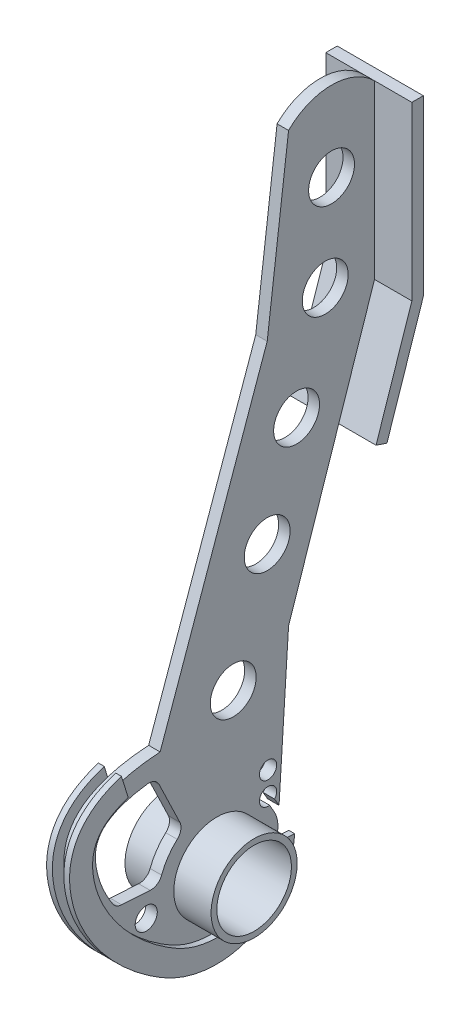
from build123d import *

# Parameters (mm, degrees)
SKETCH1_R               = 12.7
SKETCH1_R_2             = 8
SKETCH1_R_3             = 15
BOSS_EXTRUDE1_DEPTH     = 2
BOSS_EXTRUDE2_DEPTH     = 15
SKETCH3_R               = 15
SKETCH3_R_2             = 13
BOSS_EXTRUDE3_DEPTH     = 15
CUT_EXTRUDE1_DEPTH      = 269.802954327
CUT_EXTRUDE1_DEPTH_BACK = 269.802954327
BOSS_EXTRUDE4_DEPTH     = 2
CUT_EXTRUDE2_DEPTH      = 269.802954424
CUT_EXTRUDE2_DEPTH_BACK = 269.802954424
SKETCH6_R               = 3.852342377
SKETCH6_R_2             = 3
FILLET1_R               = 4
BOSS_EXTRUDE5_DEPTH     = 2
FILLET2_R               = 10


with BuildPart() as part:
    # Sketch1 → Boss-Extrude1 (new, symmetric)
    with BuildSketch(Plane(origin=(0, 0, 0), x_dir=(0, 0, -1), z_dir=(1, 0, 0))):
        with BuildLine():
            Line((30.078103468, 30.102899094), (30.078103468, 104.858637586))
            Line((30.078103468, 104.858637586), (43.656234688, 145.478166756))
            Line((43.656234688, 145.478166756), (60.038536544, 194.486485935))
            Line((60.038536544, 194.486485935), (60.038536544, 254.427096014))
            ThreePointArc((60.038536544, 254.427096014), (45.05832001, 260.632104877), (30.078103469, 254.427096029))
            Line((30.078103469, 254.427096029), (22.62926434, 194.486485916))
            Line((22.62926434, 194.486485916), (-14.683335653, 89.230795609))
            Line((-14.683335653, 89.230795609), (-17.49123357, 0.553848547))
            ThreePointArc((-17.49123357, 0.553848547), (-3.415184823, -17.163522734), (16.370945819, -6.184022397))
            Line((16.370945819, -6.184022397), (30.078103468, 30.102899094))
        make_face()
        Circle(SKETCH1_R, mode=Mode.SUBTRACT)
        with Locations((45.058319997, 232.788133995)):
            Circle(SKETCH1_R_2, mode=Mode.SUBTRACT)
        with Locations((42.85515341, 200.574247039)):
            Circle(SKETCH1_R_2, mode=Mode.SUBTRACT)
        with Locations((32.877400798, 166.36480954)):
            Circle(SKETCH1_R_2, mode=Mode.SUBTRACT)
        with Locations((22.629264347, 133.284451418)):
            Circle(SKETCH1_R_2, mode=Mode.SUBTRACT)
        with Locations((10.792452444, 95.075946031)):
            Circle(SKETCH1_R_2, mode=Mode.SUBTRACT)
        with Locations((5.075535148, 44.712849864)):
            Circle(SKETCH1_R_3, mode=Mode.SUBTRACT)
    extrude(amount=BOSS_EXTRUDE1_DEPTH, both=True)

    # Sketch2 → Boss-Extrude2 (add, symmetric)
    with BuildSketch(Plane(origin=(0, 0, 0), x_dir=(0, 0, -1), z_dir=(1, 0, 0))):
        Polygon((47.563588116, 157.167172724), (60.038536544, 194.486485935), (60.038536544, 254.427096014), (64.038536544, 254.427096014), (64.038536544, 193.835634299), (51.357247167, 155.899043786), align=None)
    extrude(amount=BOSS_EXTRUDE2_DEPTH, both=True)

    # Sketch3 → Boss-Extrude3 (add, symmetric)
    with BuildSketch(Plane(origin=(0, 0, 0), x_dir=(0, 0, -1), z_dir=(1, 0, 0))):
        with Locations((5.075535148, 44.712849864)):
            Circle(SKETCH3_R)
        with Locations((5.075535148, 44.712849864)):
            Circle(SKETCH3_R_2, mode=Mode.SUBTRACT)
    extrude(amount=BOSS_EXTRUDE3_DEPTH, both=True)

    # Sketch4 → Cut-Extrude1 (cut, two sides: drawn at the far end of the back side and taken through both)
    with BuildSketch(Plane(origin=(0, 0, 0), x_dir=(0, 0, -1), z_dir=(1, 0, 0)).offset(-CUT_EXTRUDE1_DEPTH_BACK)):
        with BuildLine():
            Line((30.078103468, 104.858637586), (26.191278068, 43.377907902))
            ThreePointArc((26.191278068, 43.377907902), (4.407731446, 23.565492882), (-16.082363356, 44.712849864))
            Line((-16.082363356, 44.712849864), (-29.154102158, 44.712849864))
            Line((-29.154102158, 44.712849864), (-29.154102158, 7.504286016))
            Line((-29.154102158, 7.504286016), (-19.281981281, -21.725135581))
            Line((-19.281981281, -21.725135581), (13.670399251, -21.725135581))
            Line((13.670399251, -21.725135581), (36.161706599, 11.227244951))
            Line((36.161706599, 11.227244951), (36.161706599, 104.858637586))
            Line((36.161706599, 104.858637586), (30.078103468, 104.858637586))
        make_face()
    extrude(amount=CUT_EXTRUDE1_DEPTH + CUT_EXTRUDE1_DEPTH_BACK, mode=Mode.SUBTRACT)

    # Sketch5 → Boss-Extrude4 (add, symmetric)
    with BuildSketch(Plane(origin=(0, 0, 0), x_dir=(0, 0, -1), z_dir=(1, 0, 0))):
        with BuildLine():
            Line((-16.082363356, 44.712849864), (-14.683335653, 89.230795609))
            add(Edge.make_bspline(
                [(-14.683335653, 89.230795609), (-43.018615037, 87.412919783), (-49.931265985, 59.370190205), (-26.511116913, 33.203575319), (2.515504255, 16.740747707), (24.905298182, 23.036633571), (26.191278068, 43.377907902)],
                knots=[0, 0, 0, 0, 0.276392856, 0.582042419, 0.658223753, 1, 1, 1, 1], degree=3))
            ThreePointArc((26.191278068, 43.377907902), (4.407731446, 23.565492882), (-16.082363356, 44.712849864))
        make_face()
    extrude(amount=BOSS_EXTRUDE4_DEPTH, both=True)

    # Sketch6 → Cut-Extrude2 (cut, two sides: drawn at the far end of the back side and taken through both)
    with BuildSketch(Plane(origin=(0, 0, 0), x_dir=(0, 0, -1), z_dir=(1, 0, 0)).offset(-CUT_EXTRUDE2_DEPTH_BACK)):
        with Locations((-19.520755852, 41.423227022)):
            Circle(SKETCH6_R)
        with Locations((22.931923345, 65.014687077)):
            Circle(SKETCH6_R_2)
        with BuildLine():
            Line((-18.167116193, 49.188244666), (-30.059033637, 49.940054331))
            add(Edge.make_bspline(
                [(-16.241939744, 82.091687894), (-16.784230913, 82.043262227), (-17.88651773, 81.932514706), (-19.93574854, 81.677748862), (-22.312481373, 81.291478525), (-24.843938902, 80.735170577), (-27.816864317, 79.889300258), (-30.79418636, 78.677162448), (-33.313350945, 77.116508933), (-34.983846176, 75.559250449), (-36.064340209, 74.017357976), (-36.773096061, 72.36348984), (-37.320511488, 69.821463318), (-37.231646879, 66.674580942), (-36.494081763, 63.131921197), (-35.412713951, 59.560213763), (-33.835666743, 56.002198971), (-31.818344114, 52.511691614), (-30.659199505, 50.78026119), (-30.059033637, 49.940054331)],
                knots=[0.007259269, 0.007259269, 0.007259269, 0.007259269, 0.013460155, 0.019661042, 0.032062816, 0.04446459, 0.056866364, 0.081669911, 0.106473459, 0.131277006, 0.156080554, 0.180884101, 0.205687649, 0.255294744, 0.280098291, 0.304901839, 0.354508934, 0.379312481, 0.404116029, 0.404116029, 0.404116029, 0.404116029], degree=3))
            Line((-16.241939744, 82.091687894), (-7.808997403, 64.568298007))
            ThreePointArc((-7.808997403, 64.568298007), (-7.486843803, 62.070471384), (-8.72128321, 59.875231049))
            ThreePointArc((-8.72128321, 59.875231049), (-11.927858504, 56.164251714), (-14.16122498, 51.797838206))
            ThreePointArc((-14.16122498, 51.797838206), (-15.731396551, 49.828705906), (-18.167116193, 49.188244666))
        make_face()
        with BuildLine():
            Line((31.823669454, 43.575587368), (25.209849057, 55.062494859))
            ThreePointArc((25.209849057, 55.062494859), (21.435005127, 59.61454012), (23.476613694, 54.064549381))
            Line((23.476613694, 54.064549381), (30.090434091, 42.577641889))
            Line((30.090434091, 42.577641889), (31.823669454, 43.575587368))
        make_face()
    extrude(amount=CUT_EXTRUDE2_DEPTH + CUT_EXTRUDE2_DEPTH_BACK, mode=Mode.SUBTRACT)

    # Fillet1
    fillet1_edges = [part.edges().sort_by_distance(p)[0] for p in [
        (-1, 82.091687894, 16.241939744),
        (-1, 49.940054331, 30.059033637),
    ]]
    fillet(fillet1_edges, radius=FILLET1_R)

    # Sketch7 → Boss-Extrude5 (add)
    with BuildSketch(Plane(origin=(2, 0, 0), x_dir=(0, 0, -1), z_dir=(1, 0, 0))):
        with BuildLine():
            Line((22.199247779, 43.630284944), (30.183308357, 43.125530859))
            add(Edge.make_bspline(
                [(-30.182273938, 90.62887795), (-30.477102104, 90.536143837), (-31.05900453, 90.346247946), (-33.79533685, 89.386547465), (-37.968857295, 87.413749324), (-42.575559344, 83.807112931), (-45.846696099, 79.421854), (-47.712994208, 74.610225126), (-48.366843365, 69.69801532), (-48.090537376, 64.861286106), (-47.147847972, 60.209356854), (-45.230633964, 54.226062721), (-41.694722437, 47.132990803), (-36.04605422, 39.362918853), (-29.349438931, 32.419037624), (-23.156184009, 27.405962501), (-18.025095774, 23.921539038), (-13.991958588, 21.55457577), (-9.676576889, 19.572373056), (-3.556790736, 17.684319723), (4.365353754, 16.872623556), (12.137866729, 18.30196283), (17.845896009, 20.987591597), (21.731924183, 23.816406725), (25.063742558, 27.474184689), (27.246456473, 31.187747742), (28.57612877, 34.529210242), (29.354831609, 37.212724993), (29.814525561, 39.595917642), (30.064712963, 41.581132894), (30.15092264, 42.613262547), (30.183308357, 43.125530859)],
                knots=[0.056021658, 0.056021658, 0.056021658, 0.056021658, 0.059927908, 0.063834158, 0.09375, 0.125, 0.15625, 0.1875, 0.21875, 0.25, 0.28125, 0.3125, 0.375, 0.4375, 0.5, 0.5625, 0.59375, 0.625, 0.65625, 0.6875, 0.75, 0.8125, 0.84375, 0.875, 0.90625, 0.9375, 0.953125, 0.96875, 0.984375, 0.9921875, 1, 1, 1, 1], degree=3))
            Line((-30.182273938, 90.62887795), (-27.781921947, 82.997475043))
            add(Edge.make_bspline(
                [(-27.781921947, 82.997475043), (-28.181432114, 82.871810055), (-29.501312357, 82.430329455), (-31.508114747, 81.608467084), (-34.292317284, 80.120837256), (-36.840380467, 78.090511183), (-38.762100202, 75.491115034), (-39.878090441, 72.647208982), (-40.32270597, 69.451995121), (-40.138116193, 65.94646467), (-39.394850917, 62.24579382), (-37.825802826, 57.339803194), (-34.850061055, 51.344537916), (-29.918346445, 44.54433997), (-23.93533809, 38.336254781), (-18.361281086, 33.820836374), (-13.711407408, 30.665251531), (-10.248947904, 28.640375887), (-6.793165076, 27.059267801), (-2.046964483, 25.596647602), (4.115058548, 24.973286066), (9.816162722, 26.057107894), (13.759601496, 27.921611258), (16.357572879, 29.817423825), (18.564582106, 32.238898797), (20.051003601, 34.755157206), (20.993446775, 37.117965368), (21.563252469, 39.075778393), (21.911653375, 40.875471752), (22.105477116, 42.410060267), (22.173757685, 43.227089696), (22.199247779, 43.630284944)],
                knots=[0.056021507, 0.056021507, 0.056021507, 0.056021507, 0.0625, 0.078125, 0.09375, 0.125, 0.15625, 0.1875, 0.21875, 0.25, 0.28125, 0.3125, 0.375, 0.4375, 0.5, 0.5625, 0.59375, 0.625, 0.65625, 0.6875, 0.75, 0.8125, 0.84375, 0.875, 0.90625, 0.9375, 0.953125, 0.96875, 0.984375, 0.9921875, 1, 1, 1, 1], degree=3))
        make_face()
    boss_extrude5 = extrude(amount=BOSS_EXTRUDE5_DEPTH)

    # Mirror1: Boss-Extrude5 across plane
    add(boss_extrude5.mirror(Plane(origin=(0, 0, 0), x_dir=(0, 0, 1), z_dir=(1, 0, 0))))

    # Fillet2
    fillet2_edges = [part.edges().sort_by_distance(p)[0] for p in [
        (0, 48.758874255, -26.531463957),
    ]]
    fillet(fillet2_edges, radius=FILLET2_R)


solid = part.part
